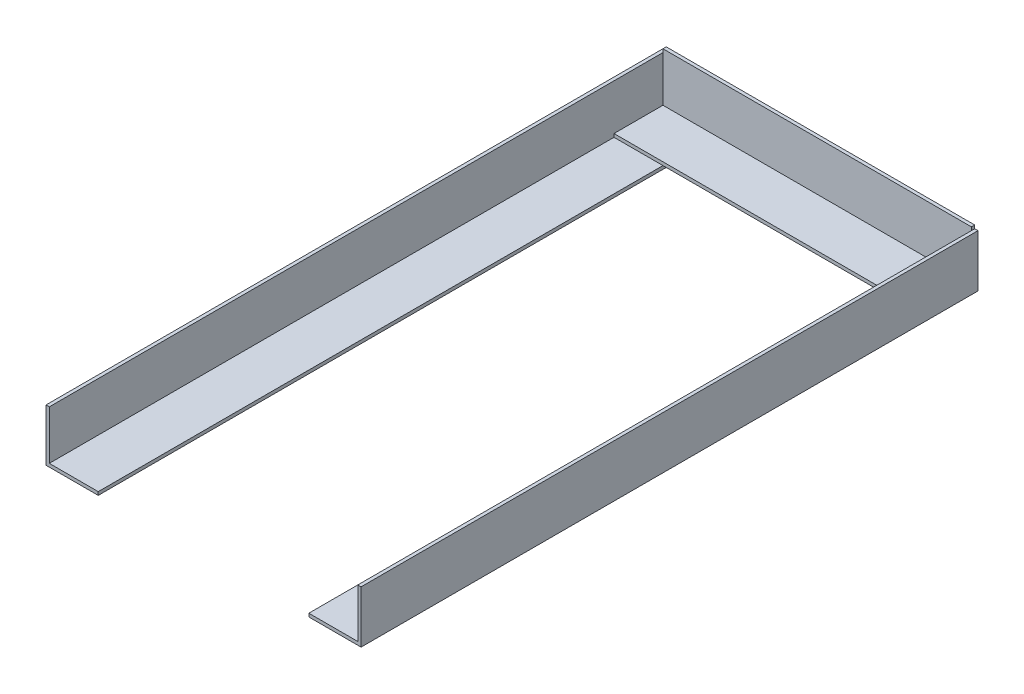
from build123d import *

# Parameters (mm, degrees)
BOSS_EXTRUDE1_DEPTH   = 300
BOSS_EXTRUDE1_2_DEPTH = 300
BOSS_EXTRUDE2_DEPTH   = 150


with BuildPart() as part:
    # Sketch1 → Boss-Extrude1 (new body)
    with BuildSketch(Plane.XY):
        Polygon((25.4, 0), (0, 0), (0, 25.4), (1.6002, 25.4), (1.6002, 1.6002), (25.4, 1.6002), align=None)
    extrude(amount=-BOSS_EXTRUDE1_DEPTH)



with BuildPart() as body_2:
    # Sketch1 → Boss-Extrude1 2 (new body)
    with BuildSketch(Plane.XY):
        Polygon((153.2004, 25.4), (151.6002, 25.4), (151.6002, 1.6002), (127.8004, 1.6002), (127.8004, 0), (153.2004, 0), align=None)
    extrude(amount=-BOSS_EXTRUDE1_2_DEPTH)


with BuildPart() as part_1:
    add(part.part)

    add(body_2.part)  # Boss-Extrude2 merges body 2
    # Sketch2 → Boss-Extrude2 (add)
    with BuildSketch(Plane(origin=(1.6002, 0, 0), x_dir=(0, 0, -1), z_dir=(1, 0, 0))):
        Polygon((274.6, 1.6002), (300, 1.6002), (300, 27.0002), (298.3998, 27.0002), (298.3998, 3.2004), (274.6, 3.2004), align=None)
    extrude(amount=BOSS_EXTRUDE2_DEPTH)


solid = part_1.part
